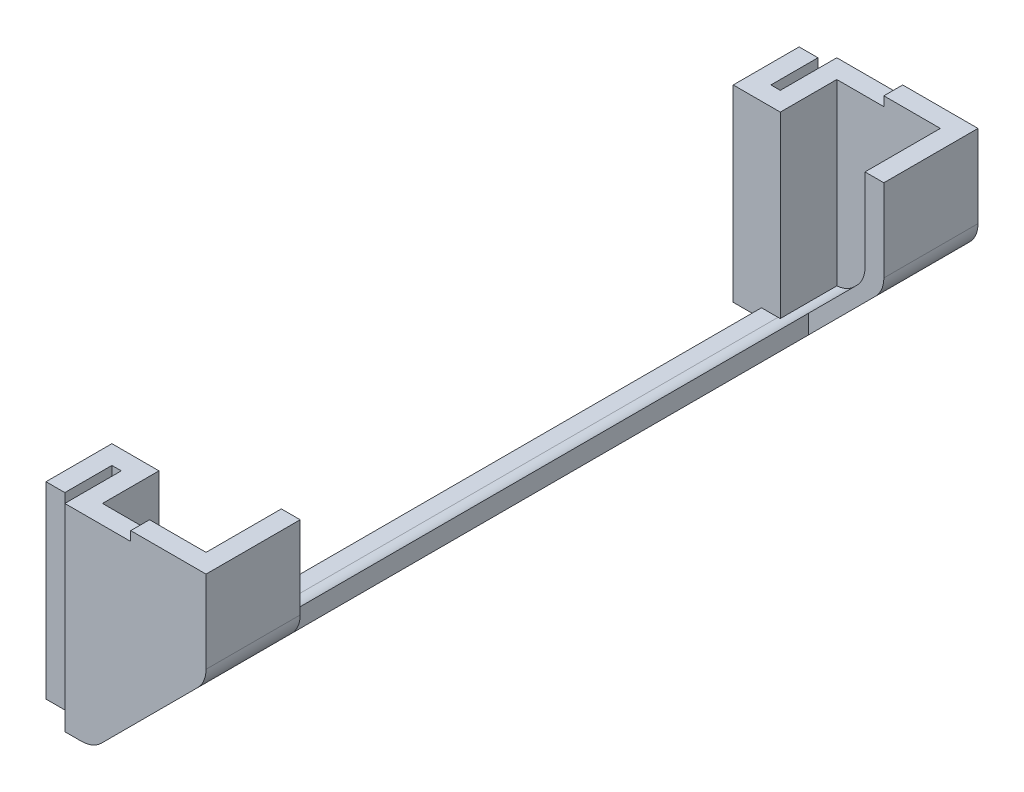
from build123d import *

# Parameters (mm, degrees)
EXTRUDE_1_DEPTH       = 82
FILLET_1_R            = 3
EXTRUDE_START         = -2
EXTRUDE_2_DEPTH       = 2
EXTRUDE_START_2       = -82
EXTRUDE_3_DEPTH       = 2
CUT_EXTRUDE_1_DEPTH   = 2
CUT_EXTRUDE_2_DEPTH   = 2
CUT_EXTRUDE_3_REACH   = 114.805
SKETCH_7_R            = 2
SKETCH_7_R_2          = 3.3
SKETCH_8_R            = 2
EXTRUDE_4_DEPTH       = 18
SKETCH_9_W            = 7
SKETCH_9_H            = 20
EXTRUDE_5_DEPTH       = 2
SKETCH_10_W           = 2
SKETCH_10_H           = 20
EXTRUDE_6_DEPTH       = 1
SKETCH_11_W           = 7
SKETCH_11_H           = 20
EXTRUDE_7_DEPTH       = 2
SKETCH_12_OUTSIDE_W   = 111.698
SKETCH_12_OUTSIDE_H   = 75.698
SKETCH_12_OUTSIDE_W_2 = 10
SKETCH_12_OUTSIDE_H_2 = 22
CUT_EXTRUDE_4_DEPTH   = 8
SKETCH_14_W           = 93.129876152
SKETCH_14_H           = 88.449918806
CUT_EXTRUDE_5_DEPTH   = 108.745069493


with BuildPart() as part:
    # 草图1 → 凸台-拉伸1 (new body)
    with BuildSketch(Plane.XY):
        Polygon((0, 0), (0, 2), (3, 2), (13, 12), (13, 37), (3, 47), (-60, 47), (-60, 49), (3, 49), (15, 37), (15, 12), (3, 0), align=None)
    extrude(amount=EXTRUDE_1_DEPTH)

    # 圆角1
    fillet_1_edges = [part.edges().sort_by_distance(p)[0] for p in [
        (3, 0, 41),
        (15, 12, 41),
        (15, 37, 41),
        (3, 49, 41),
        (3, 2, 41),
        (13, 12, 41),
        (13, 37, 41),
        (3, 47, 41),
    ]]
    fillet(fillet_1_edges, radius=FILLET_1_R)

    # 草图4 → 凸台-拉伸2 (add)
    with BuildSketch(Plane(origin=(0, 0, 0), x_dir=(-1, 0, 0), z_dir=(0, 0, -1)).offset(EXTRUDE_START)):
        with BuildLine():
            Line((0, 0), (0, 26))
            Line((0, 26), (4, 26))
            Line((4, 26), (4, 27))
            Line((4, 27), (60, 27))
            Line((60, 27), (60, 49))
            Line((60, 49), (-1.757359313, 49))
            ThreePointArc((-1.757359313, 49), (-2.90540961, 48.771638598), (-3.878679656, 48.121320344))
            Line((-3.878679656, 48.121320344), (-14.121320344, 37.878679656))
            ThreePointArc((-14.121320344, 37.878679656), (-14.771638598, 36.90540961), (-15, 35.757359313))
            Line((-15, 35.757359313), (-15, 13.242640687))
            ThreePointArc((-15, 13.242640687), (-14.771638598, 12.09459039), (-14.121320344, 11.121320344))
            Line((-14.121320344, 11.121320344), (-3.878679656, 0.878679656))
            ThreePointArc((-3.878679656, 0.878679656), (-2.90540961, 0.228361402), (-1.757359313, 0))
            Line((-1.757359313, 0), (0, 0))
        make_face()
    extrude(amount=EXTRUDE_2_DEPTH)

    # 草图4<2> → 凸台-拉伸3 (add)
    with BuildSketch(Plane(origin=(0, 0, 0), x_dir=(-1, 0, 0), z_dir=(0, 0, -1)).offset(EXTRUDE_START_2)):
        with BuildLine():
            Line((0, 0), (0, 26))
            Line((0, 26), (4, 26))
            Line((4, 26), (4, 27))
            Line((4, 27), (60, 27))
            Line((60, 27), (60, 49))
            Line((60, 49), (-1.757359313, 49))
            ThreePointArc((-1.757359313, 49), (-2.90540961, 48.771638598), (-3.878679656, 48.121320344))
            Line((-3.878679656, 48.121320344), (-14.121320344, 37.878679656))
            ThreePointArc((-14.121320344, 37.878679656), (-14.771638598, 36.90540961), (-15, 35.757359313))
            Line((-15, 35.757359313), (-15, 13.242640687))
            ThreePointArc((-15, 13.242640687), (-14.771638598, 12.09459039), (-14.121320344, 11.121320344))
            Line((-14.121320344, 11.121320344), (-3.878679656, 0.878679656))
            ThreePointArc((-3.878679656, 0.878679656), (-2.90540961, 0.228361402), (-1.757359313, 0))
            Line((-1.757359313, 0), (0, 0))
        make_face()
    extrude(amount=EXTRUDE_3_DEPTH)

    # 草图5 → 切除-拉伸1 (cut)
    with BuildSketch(Plane(origin=(0, 0, 0), x_dir=(-1, 0, 0), z_dir=(0, 0, -1))):
        Polygon((2.661599935, 45.0208), (2.661599935, 31), (0, 31), (0, 29.863095934), (55.9999896, 29.863095934), (55.9999896, 31), (53.469479015, 31), (53.469479015, 44.2999988), (37.469480535, 44.2999988), (37.469480535, 31), (36.113001155, 31), (36.113001155, 38.112), (19.512998795, 38.112), (19.512998795, 31), (17.861600015, 31), (17.861600015, 45.0208), align=None)
    extrude(amount=-CUT_EXTRUDE_1_DEPTH, mode=Mode.SUBTRACT)

    # 草图6 → 切除-拉伸2 (cut)
    with BuildSketch(Plane.XY.offset(82)):
        Polygon((-55.9999896, 31), (-49.543385864, 31), (-49.543385864, 37.1214), (-33.143393264, 37.1214), (-33.143393264, 32.1214), (-29.143393264, 32.1214), (-29.143393264, 31), (-10.34416017, 31), (-10.34416017, 33.50000008), (-6.34416055, 33.50000008), (-6.34416055, 31), (0, 31), (0, 27), (0, 26), (-4, 26), (-4, 27), (-55.9999896, 27), align=None)
    extrude(amount=-CUT_EXTRUDE_2_DEPTH, mode=Mode.SUBTRACT)

    # 草图7 → 切除-拉伸3 (cut, up to next)
    with BuildSketch(Plane(origin=(0, 49, 0), x_dir=(1, 0, 0), z_dir=(0, 1, 0)), mode=Mode.PRIVATE) as cut_extrude_3_sk1:
        with Locations((-52.4947896, -81.4948)):
            Circle(SKETCH_7_R)
    cut_extrude_3_tool1 = extrude(cut_extrude_3_sk1.sketch, amount=-CUT_EXTRUDE_3_REACH, mode=Mode.PRIVATE) & part.part
    # 草图7 → 切除-拉伸3 (cut, up to next)
    with BuildSketch(Plane(origin=(0, 49, 0), x_dir=(1, 0, 0), z_dir=(0, 1, 0)), mode=Mode.PRIVATE) as cut_extrude_3_sk2:
        with Locations((-3.4981896, -81.4948)):
            Circle(SKETCH_7_R)
    cut_extrude_3_tool2 = extrude(cut_extrude_3_sk2.sketch, amount=-CUT_EXTRUDE_3_REACH, mode=Mode.PRIVATE) & part.part
    # 草图7 → 切除-拉伸3 (cut, up to next)
    with BuildSketch(Plane(origin=(0, 49, 0), x_dir=(1, 0, 0), z_dir=(0, 1, 0)), mode=Mode.PRIVATE) as cut_extrude_3_sk3:
        with Locations((-43.742640687, -20.5)):
            Circle(SKETCH_7_R_2)
    cut_extrude_3_tool3 = extrude(cut_extrude_3_sk3.sketch, amount=-CUT_EXTRUDE_3_REACH, mode=Mode.PRIVATE) & part.part
    # 草图7 → 切除-拉伸3 (cut, up to next)
    with BuildSketch(Plane(origin=(0, 49, 0), x_dir=(1, 0, 0), z_dir=(0, 1, 0)), mode=Mode.PRIVATE) as cut_extrude_3_sk4:
        with Locations((-2.742640687, -20.5)):
            Circle(SKETCH_7_R_2)
    cut_extrude_3_tool4 = extrude(cut_extrude_3_sk4.sketch, amount=-CUT_EXTRUDE_3_REACH, mode=Mode.PRIVATE) & part.part
    # 草图7 → 切除-拉伸3 (cut, up to next)
    with BuildSketch(Plane(origin=(0, 49, 0), x_dir=(1, 0, 0), z_dir=(0, 1, 0)), mode=Mode.PRIVATE) as cut_extrude_3_sk5:
        with Locations((-2.742640687, -61.5)):
            Circle(SKETCH_7_R_2)
    cut_extrude_3_tool5 = extrude(cut_extrude_3_sk5.sketch, amount=-CUT_EXTRUDE_3_REACH, mode=Mode.PRIVATE) & part.part
    # 草图7 → 切除-拉伸3 (cut, up to next)
    with BuildSketch(Plane(origin=(0, 49, 0), x_dir=(1, 0, 0), z_dir=(0, 1, 0)), mode=Mode.PRIVATE) as cut_extrude_3_sk6:
        with Locations((-43.742640687, -61.5)):
            Circle(SKETCH_7_R_2)
    cut_extrude_3_tool6 = extrude(cut_extrude_3_sk6.sketch, amount=-CUT_EXTRUDE_3_REACH, mode=Mode.PRIVATE) & part.part
    # 草图7 → 切除-拉伸3 (cut, up to next)
    with BuildSketch(Plane(origin=(0, 49, 0), x_dir=(1, 0, 0), z_dir=(0, 1, 0)), mode=Mode.PRIVATE) as cut_extrude_3_sk7:
        with BuildLine():
            Line((-50, -66), (-50, -78))
            Line((-50, -78), (-53.9999896, -78))
            ThreePointArc((-53.9999896, -78), (-55.414203162, -78.585786438), (-55.9999896, -80))
            Line((-55.9999896, -80), (-60, -80))
            Line((-60, -80), (-60, -23.494789))
            ThreePointArc((-60, -23.494789), (-59.121320344, -25.616109344), (-57, -26.494789))
            Line((-57, -26.494789), (-52.436945771, -26.494789))
            ThreePointArc((-52.436945771, -26.494789), (-50.713764891, -27.208553891), (-50, -28.931734771))
            Line((-50, -28.931734771), (-50, -41))
            Line((-50, -41), (-50, -66))
        make_face()
    cut_extrude_3_tool7 = extrude(cut_extrude_3_sk7.sketch, amount=-CUT_EXTRUDE_3_REACH, mode=Mode.PRIVATE) & part.part
    # 草图7 → 切除-拉伸3 (cut, up to next)
    with BuildSketch(Plane(origin=(0, 49, 0), x_dir=(1, 0, 0), z_dir=(0, 1, 0)), mode=Mode.PRIVATE) as cut_extrude_3_sk8:
        with BuildLine():
            Line((-38.742640687, -20.5), (-38.742640687, -16))
            Line((-38.742640687, -16), (-7.742640687, -16))
            Line((-7.742640687, -16), (-7.742640687, -20.5))
            ThreePointArc((-7.742640687, -20.5), (-6.278174593, -24.035533906), (-2.742640687, -25.5))
            Line((-2.742640687, -25.5), (1.757359313, -25.5))
            Line((1.757359313, -25.5), (1.757359313, -56.5))
            Line((1.757359313, -56.5), (-2.742640687, -56.5))
            ThreePointArc((-2.742640687, -56.5), (-6.278174593, -57.964466094), (-7.742640687, -61.5))
            Line((-7.742640687, -61.5), (-7.742640687, -66))
            Line((-7.742640687, -66), (-38.742640687, -66))
            Line((-38.742640687, -66), (-38.742640687, -61.5))
            ThreePointArc((-38.742640687, -61.5), (-40.207106781, -57.964466094), (-43.742640687, -56.5))
            Line((-43.742640687, -56.5), (-48.242640687, -56.5))
            Line((-48.242640687, -56.5), (-48.242640687, -25.5))
            Line((-48.242640687, -25.5), (-43.742640687, -25.5))
            ThreePointArc((-43.742640687, -25.5), (-40.207106781, -24.035533906), (-38.742640687, -20.5))
        make_face()
    cut_extrude_3_tool8 = extrude(cut_extrude_3_sk8.sketch, amount=-CUT_EXTRUDE_3_REACH, mode=Mode.PRIVATE) & part.part
    add(cut_extrude_3_tool1.solids().sort_by_distance((-52.49479, 49, 81.4948))[0], mode=Mode.SUBTRACT)
    add(cut_extrude_3_tool2.solids().sort_by_distance((-3.49819, 49, 81.4948))[0], mode=Mode.SUBTRACT)
    add(cut_extrude_3_tool3.solids().sort_by_distance((-43.742641, 49, 20.5))[0], mode=Mode.SUBTRACT)
    add(cut_extrude_3_tool4.solids().sort_by_distance((-2.742641, 49, 20.5))[0], mode=Mode.SUBTRACT)
    add(cut_extrude_3_tool5.solids().sort_by_distance((-2.742641, 49, 61.5))[0], mode=Mode.SUBTRACT)
    add(cut_extrude_3_tool6.solids().sort_by_distance((-43.742641, 49, 61.5))[0], mode=Mode.SUBTRACT)
    add(cut_extrude_3_tool7.solids().sort_by_distance((-55.073425, 49, 52.662221))[0], mode=Mode.SUBTRACT)
    add(cut_extrude_3_tool8.solids().sort_by_distance((-23.242641, 49, 41))[0], mode=Mode.SUBTRACT)

    # 草图8 → 凸台-拉伸4 (add)
    # profile 1 of 2: a face of its own
    with BuildSketch(Plane(origin=(0, 49, 0), x_dir=(1, 0, 0), z_dir=(0, 1, 0))):
        with BuildLine():
            Line((-6.34416055, -79), (0, -79))
            Line((0, -79), (0, -82))
            ThreePointArc((0, -82), (-0.878677535, -84.121318222), (-2.999994, -85))
            Line((-2.999994, -85), (-6.34416055, -85))
            Line((-6.34416055, -85), (-6.34416055, -82))
            Line((-6.34416055, -82), (-6.34416055, -79))
        make_face()
        with Locations((-3.4981896, -81.4948)):
            Circle(SKETCH_8_R, mode=Mode.SUBTRACT)
    # profile 2 of 2: a face of its own
    with BuildSketch(Plane(origin=(0, 49, 0), x_dir=(1, 0, 0), z_dir=(0, 1, 0))):
        with BuildLine():
            Line((-49.543385864, -82), (-49.543385864, -79))
            Line((-49.543385864, -79), (-55.9999896, -79))
            Line((-55.9999896, -79), (-55.9999896, -82))
            ThreePointArc((-55.9999896, -82), (-55.121313822, -84.12131998), (-52.9999956, -85))
            Line((-52.9999956, -85), (-49.543385856, -85))
            Line((-49.543385856, -85), (-49.543385864, -82))
        make_face()
        with Locations((-52.4947896, -81.4948)):
            Circle(SKETCH_8_R, mode=Mode.SUBTRACT)
    extrude(amount=-EXTRUDE_4_DEPTH)

    # 草图9 → 凸台-拉伸5 (add)
    with BuildSketch(Plane.ZY):
        with Locations((4.5, 11)):
            Rectangle(SKETCH_9_W, SKETCH_9_H)
        with Locations((77.5, 11)):
            Rectangle(SKETCH_9_W, SKETCH_9_H)
    extrude(amount=-EXTRUDE_5_DEPTH)

    # 草图10 → 凸台-拉伸6 (add)
    with BuildSketch(Plane.ZY):
        with Locations((7, 11)):
            Rectangle(SKETCH_10_W, SKETCH_10_H)
        with Locations((75, 11)):
            Rectangle(SKETCH_10_W, SKETCH_10_H)
    extrude(amount=EXTRUDE_6_DEPTH)

    # 草图11 → 凸台-拉伸7 (add)
    with BuildSketch(Plane.ZY.offset(1)):
        with Locations((4.5, 11)):
            Rectangle(SKETCH_11_W, SKETCH_11_H)
        with Locations((77.5, 11)):
            Rectangle(SKETCH_11_W, SKETCH_11_H)
    extrude(amount=EXTRUDE_7_DEPTH)

    # 草图12 outside → 切除-拉伸4 (cut)
    with BuildSketch(Plane(origin=(15, 0, 0), x_dir=(0, 0, -1), z_dir=(1, 0, 0))):
        with Locations((-42.5, 24.5)):
            Rectangle(SKETCH_12_OUTSIDE_W, SKETCH_12_OUTSIDE_H)
        with Locations((-77, 11)):
            Rectangle(SKETCH_12_OUTSIDE_W_2, SKETCH_12_OUTSIDE_H_2, mode=Mode.SUBTRACT)
        with Locations((-5, 11)):
            Rectangle(SKETCH_12_OUTSIDE_W_2, SKETCH_12_OUTSIDE_H_2, mode=Mode.SUBTRACT)
    extrude(amount=-CUT_EXTRUDE_4_DEPTH, mode=Mode.SUBTRACT)

    # 草图14 → 切除-拉伸5 (cut, through all)
    with BuildSketch(Plane(origin=(0, 21, 0), x_dir=(1, 0, 0), z_dir=(0, 1, 0))):
        with Locations((-39.564938076, -44.224959403)):
            Rectangle(SKETCH_14_W, SKETCH_14_H)
    extrude(amount=CUT_EXTRUDE_5_DEPTH, mode=Mode.SUBTRACT)


solid = part.part
